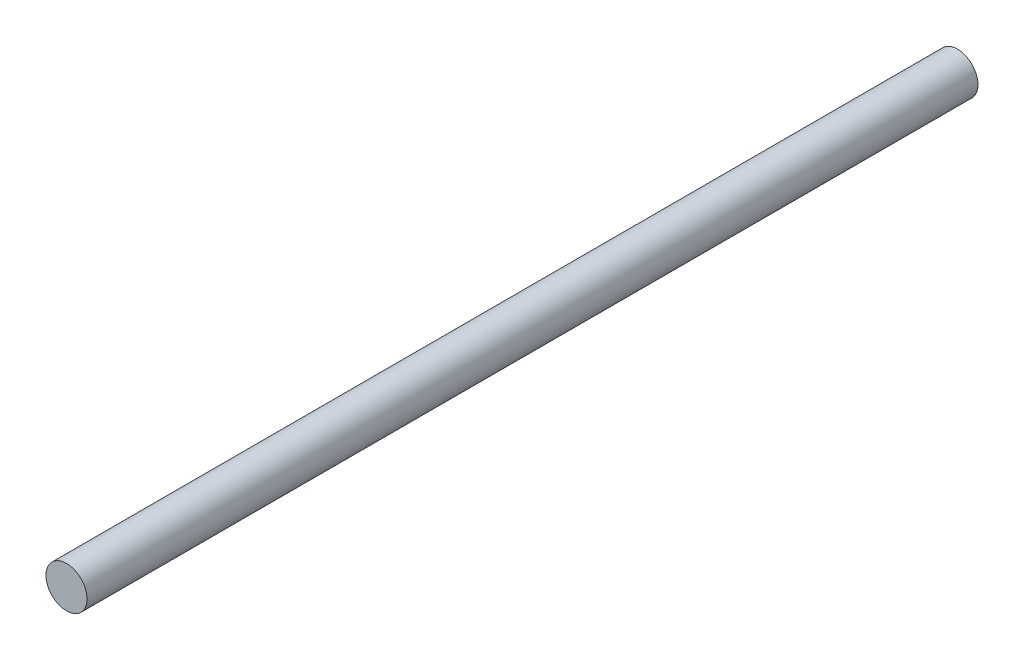
from build123d import *

# Parameters (mm, degrees)
SKETCH1_R           = 1.5
BOSS_EXTRUDE1_DEPTH = 65


with BuildPart() as part:
    # Sketch1 → Boss-Extrude1 (new body)
    with BuildSketch(Plane.XY):
        Circle(SKETCH1_R)
    extrude(amount=BOSS_EXTRUDE1_DEPTH)


solid = part.part
